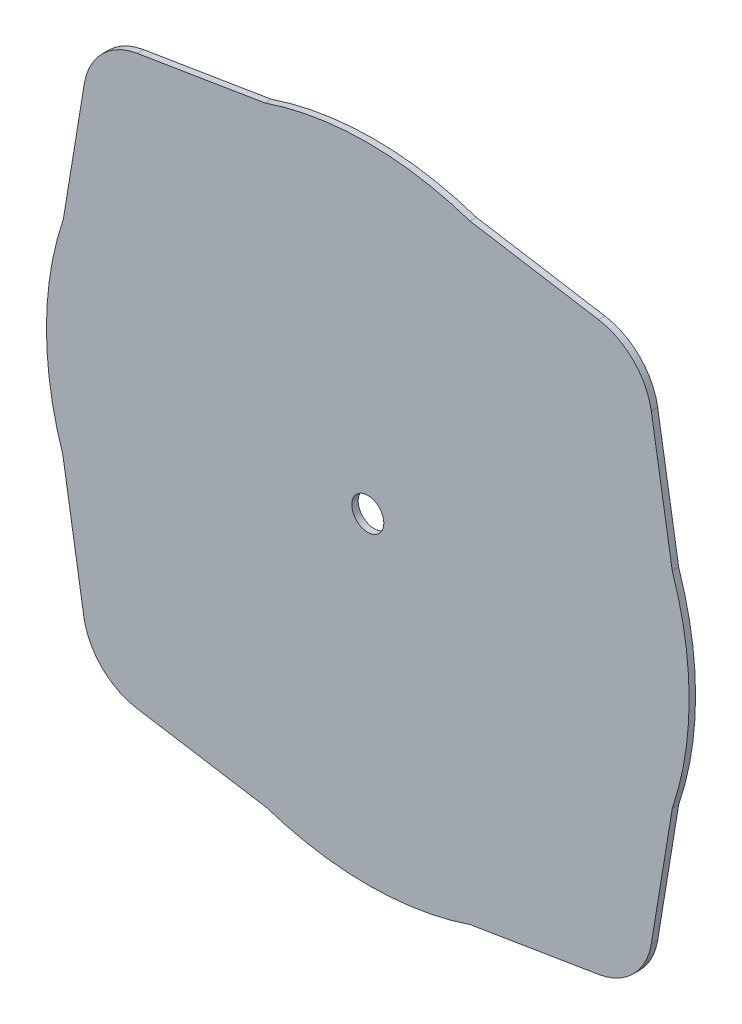
from build123d import *

# Parameters (mm, degrees)
SKETCH1_R           = 12.7
BOSS_EXTRUDE1_DEPTH = 5.08
SCALE1_SCALE        = 0.5


with BuildPart() as part:
    # Sketch1 → Boss-Extrude1 (new body)
    with BuildSketch(Plane.XY):
        with BuildLine():
            Line((93.467932513, -187.929219557), (-8.040338021, -204.583155787))
            ThreePointArc((-8.040338021, -204.583155787), (-88.944478372, -217.943504644), (-169.903751816, -204.921412232))
            Line((-169.903751816, -204.921412232), (-272.655005044, -188.283976468))
            ThreePointArc((-272.655005044, -188.283976468), (-300.456269849, -174.058121661), (-314.682124657, -146.256856856))
            Line((-314.682124657, -146.256856856), (-331.319560421, -43.505603627))
            ThreePointArc((-331.319560421, -43.505603627), (-344.341652832, 37.453669817), (-330.981303976, 118.357810167))
            Line((-330.981303976, 118.357810167), (-314.329829255, 219.851077431))
            ThreePointArc((-314.329829255, 219.851077431), (-300.11395964, 247.554656272), (-272.404769628, 261.75958564))
            Line((-272.404769628, 261.75958564), (-171.233737428, 278.317171496))
            ThreePointArc((-171.233737428, 278.317171496), (-89.808861292, 291.785970897), (-8.349194575, 278.529209999))
            Line((-8.349194575, 278.529209999), (93.484449571, 261.782540046))
            ThreePointArc((93.484449571, 261.782540046), (121.168832583, 247.570102588), (135.370852074, 219.880373742))
            Line((135.370852074, 219.880373742), (152.027133289, 118.357810167))
            ThreePointArc((152.027133289, 118.357810167), (165.388038657, 36.921062845), (152.027133289, -44.515684477))
            Line((152.027133289, -44.515684477), (135.373197059, -146.023955011))
            ThreePointArc((135.373197059, -146.023955011), (121.164420099, -173.720442597), (93.467932513, -187.929219557))
        make_face()
        with Locations((-89.477085343, 36.921062845)):
            Circle(SKETCH1_R, mode=Mode.SUBTRACT)
    extrude(amount=BOSS_EXTRUDE1_DEPTH)


with BuildPart() as part_1:
    # Scale1: scaled about (-89.546856293, 36.846362698, 2.54)
    add(part.part.scale(SCALE1_SCALE).moved(Location((-44.773428147, 18.423181349, 1.27))))


solid = part_1.part
